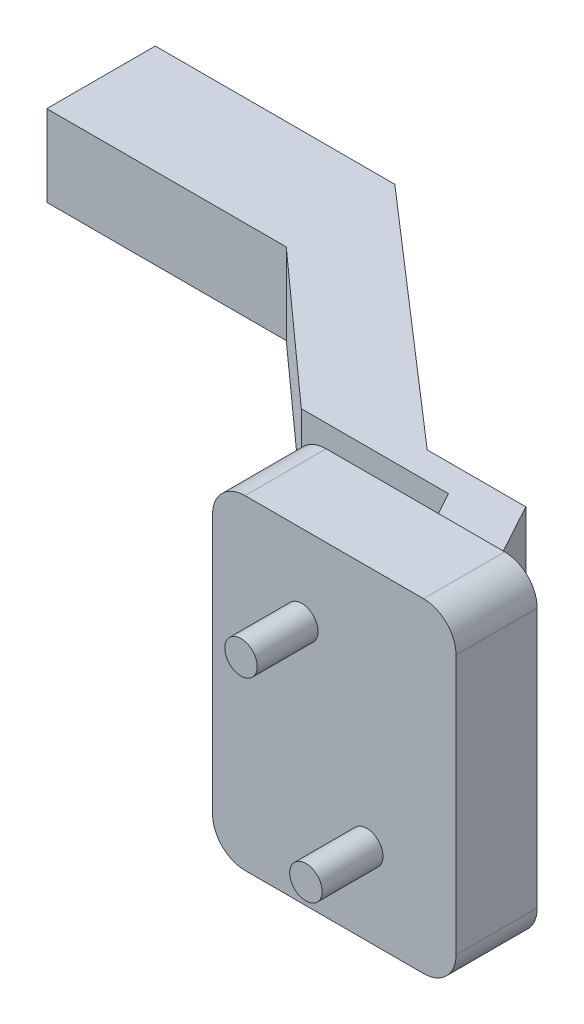
from build123d import *

# Parameters (mm, degrees)
ESQUISSE1_R             = 1
BOSS_EXTRU_1_DEPTH      = 3.75
BOSS_EXTRU_1_2_DEPTH    = 3.75
BOSS_EXTRU_2_DEPTH      = 5
BOSS_EXTRU_3_DEPTH      = 2.5
BOSS_EXTRU_3_DEPTH_BACK = 2.5
BOSS_EXTRU_4_START      = -5
BOSS_EXTRU_4_DEPTH      = 5
ENL_V_MAT_EXTRU_1_DEPTH = 10


with BuildPart() as part:
    # Esquisse1 → Boss.-Extru.1 (new body)
    with BuildSketch(Plane.XY):
        with Locations((-2, 5)):
            Circle(ESQUISSE1_R)
    extrude(amount=BOSS_EXTRU_1_DEPTH)



with BuildPart() as body_2:
    # Esquisse1 → Boss.-Extru.1 2 (new body)
    with BuildSketch(Plane.XY):
        with Locations((2, -5)):
            Circle(ESQUISSE1_R)
    extrude(amount=BOSS_EXTRU_1_2_DEPTH)


with BuildPart() as part_1:
    add(part.part)

    add(body_2.part)  # Boss.-Extru.2 merges body 2
    # Esquisse2 → Boss.-Extru.2 (add)
    with BuildSketch(Plane.XY):
        with BuildLine():
            Line((-5.5, -10), (5.5, -10))
            ThreePointArc((5.5, -10), (6.914213562, -9.414213562), (7.5, -8))
            Line((7.5, -8), (7.5, 8))
            ThreePointArc((7.5, 8), (6.914213562, 9.414213562), (5.5, 10))
            Line((5.5, 10), (-5.5, 10))
            ThreePointArc((-5.5, 10), (-6.914213562, 9.414213562), (-7.5, 8))
            Line((-7.5, 8), (-7.5, -8))
            ThreePointArc((-7.5, -8), (-6.914213562, -9.414213562), (-5.5, -10))
        make_face()
    extrude(amount=-BOSS_EXTRU_2_DEPTH)

    # Esquisse3 → Boss.-Extru.3 (add, two sides: drawn at the far end of the back side and taken through both)
    with BuildSketch(Plane(origin=(0, 0, 0), x_dir=(1, 0, 0), z_dir=(0, 1, 0)).offset(-BOSS_EXTRU_3_DEPTH_BACK)):
        Polygon((-15.908235074, 13.872743974), (-15.908235074, 15.554043285), (-3.755300915, 15.554043285), (2, 5), (-2, 5), (-6.838459549, 13.872743974), align=None)
    extrude(amount=BOSS_EXTRU_3_DEPTH + BOSS_EXTRU_3_DEPTH_BACK)

    # Esquisse4 → Boss.-Extru.4 (add)
    with BuildSketch(Plane.XZ.offset(2.5).offset(BOSS_EXTRU_4_START)):
        Polygon((-9.831767995, -15.554043285), (-24.998481753, -28.725072904), (-74.998481753, -28.725072904), (-74.998481753, -22.039407789), (-24.998481753, -22.039407789), (-15.908235074, -13.872743974), align=None)
    extrude(amount=BOSS_EXTRU_4_DEPTH)

    # Esquisse6 → Enlèv. mat.-Extru.1 (cut)
    with BuildSketch(Plane(origin=(0, 0, -28.725072904), x_dir=(-1, 0, 0), z_dir=(0, 0, -1))):
        Polygon((39.752900497, -2.5), (39.752900497, 2.5), (50.637754923, 9.880645694), (75.638904933, 6.190322847), (75.638904933, -4.915953291), (39.752900497, -8.60093005), align=None)
    extrude(amount=-ENL_V_MAT_EXTRU_1_DEPTH, mode=Mode.SUBTRACT)


solid = part_1.part
